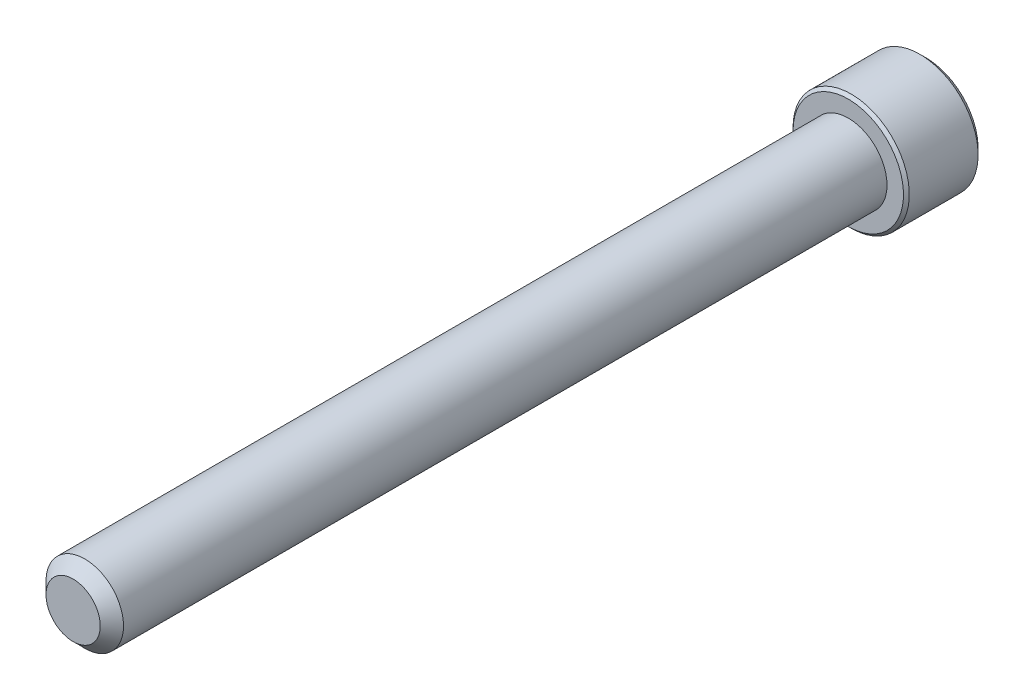
from build123d import *

# Parameters (mm, degrees)
SKETCH1_R          = 3.175
EXTRUDE1_DEPTH     = 63.5
CHAMFER3_SIZE      = 0.9525
SKETCH6_R          = 4.7625
EXTRUDE2_DEPTH     = 6.35
CUT_EXTRUDE1_DEPTH = 3.571875
CHAMFER1_SIZE      = 0.47625
CHAMFER2_SIZE      = 0.238125


with BuildPart() as part:
    # Sketch1 → Extrude1 (new body)
    with BuildSketch(Plane.XY):
        Circle(SKETCH1_R)
    extrude(amount=-EXTRUDE1_DEPTH)

    # Chamfer3
    chamfer3_edges = [part.edges().sort_by_distance(p)[0] for p in [
        (-3.175, 0, 0),
    ]]
    chamfer(chamfer3_edges, length=CHAMFER3_SIZE)

    # Sketch6 → Extrude2 (add)
    with BuildSketch(Plane(origin=(0, 0, -63.5), x_dir=(-1, 0, 0), z_dir=(0, 0, -1))):
        Circle(SKETCH6_R)
    extrude(amount=EXTRUDE2_DEPTH)

    # Sketch7 → Cut-Extrude1 (cut)
    with BuildSketch(Plane(origin=(0, 0, -69.85), x_dir=(-1, 0, 0), z_dir=(0, 0, -1))):
        Polygon((0, 2.749630657), (-2.38125, 1.374815329), (-2.38125, -1.374815329), (0, -2.749630657), (2.38125, -1.374815329), (2.38125, 1.374815329), align=None)
    extrude(amount=-CUT_EXTRUDE1_DEPTH, mode=Mode.SUBTRACT)

    # Cut-Extrude2 cone 1 section (through the dimple's axis) → Cut-Extrude2 (revolve, cut)
    with BuildSketch(Plane(origin=(0, 0, -69.85), x_dir=(0, 1, 0), z_dir=(1, 0, 0))):
        Polygon((0, 0), (2.749630657, 0), (0, 2.749630657), align=None)
    revolve(axis=Axis((0, 0, -69.85), (0, 0, 1)), mode=Mode.SUBTRACT)

    # Chamfer1
    chamfer1_edges = [part.edges().sort_by_distance(p)[0] for p in [
        (4.7625, 0, -69.85),
    ]]
    chamfer(chamfer1_edges, length=CHAMFER1_SIZE)

    # Chamfer2
    chamfer2_edges = [part.edges().sort_by_distance(p)[0] for p in [
        (4.7625, 0, -63.5),
    ]]
    chamfer(chamfer2_edges, length=CHAMFER2_SIZE)


solid = part.part
